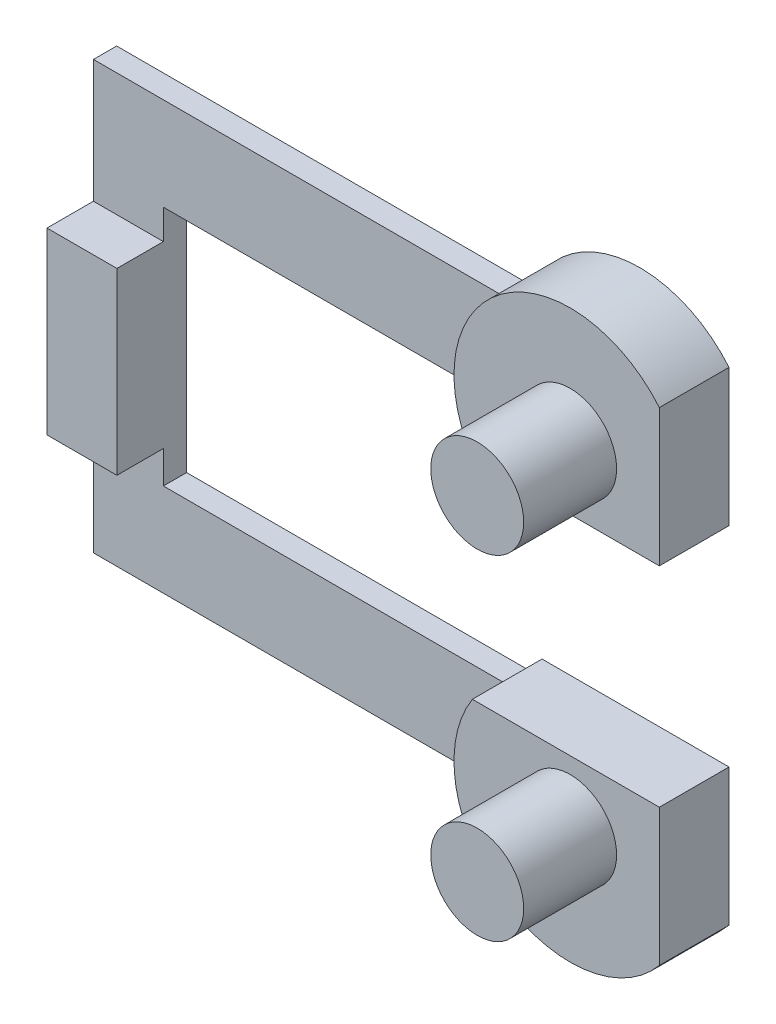
from build123d import *

# Parameters (mm, degrees)
SKIZZE2_R                         = 2
AUFSATZ_LINEAR_AUSTRAGEN1_DEPTH   = 6
AUFSATZ_LINEAR_AUSTRAGEN1_2_DEPTH = 6
SKIZZE3_W                         = 22.523994606
SKIZZE3_H                         = 4.003536954
SKIZZE3_W_2                       = 3.011174253
SKIZZE3_H_2                       = 10.396463046
AUFSATZ_LINEAR_AUSTRAGEN2_DEPTH   = 1
SKIZZE4_R                         = 5
AUFSATZ_LINEAR_AUSTRAGEN3_DEPTH   = 1
AUFSATZ_LINEAR_START              = 2
SKIZZE5_R                         = 5
AUFSATZ_LINEAR_AUSTRAGEN4_DEPTH   = 2
SKIZZE6_W                         = 13
SKIZZE6_H                         = 8.996463046
SCHNITT_LINEAR_AUSTRAGEN1_DEPTH   = 4.8
SKIZZE7_W                         = 2.020513934
SKIZZE7_H                         = 22.861740996
SCHNITT_LINEAR_AUSTRAGEN2_DEPTH   = 4.8
SKIZZE8_W                         = 3.011174253
SKIZZE8_H                         = 7.714308529
AUFSATZ_LINEAR_AUSTRAGEN5_DEPTH   = 2


with BuildPart() as part:
    # Skizze2 → Aufsatz-Linear austragen1 (new body)
    with BuildSketch(Plane.XY):
        with Locations((50.173867598, 14.290447118)):
            Circle(SKIZZE2_R)
    extrude(amount=AUFSATZ_LINEAR_AUSTRAGEN1_DEPTH)

    # Skizze3 → Aufsatz-Linear austragen2 (add)
    with BuildSketch(Plane(origin=(0, 0, 0), x_dir=(-1, 0, 0), z_dir=(0, 0, -1))):
        with Locations((-38.911870295, 14.288678641)):
            Rectangle(SKIZZE3_W, SKIZZE3_H)
        with Locations((-29.155460119, 7.088678641)):
            Rectangle(SKIZZE3_W_2, SKIZZE3_H_2)
        with BuildLine():
            Line((-30.661047245, 1.890447118), (-50.173867598, 1.890447118))
            ThreePointArc((-50.173867598, 1.890447118), (-48.759654035, 1.30466068), (-48.173867598, -0.109552882))
            ThreePointArc((-48.173867598, -0.109552882), (-48.759654035, -1.523766445), (-50.173867598, -2.109552882))
            Line((-50.173867598, -2.109552882), (-27.649872992, -2.109552882))
            Line((-27.649872992, -2.109552882), (-27.649872992, 1.890447118))
            Line((-27.649872992, 1.890447118), (-30.661047245, 1.890447118))
        make_face()
    extrude(amount=AUFSATZ_LINEAR_AUSTRAGEN2_DEPTH)



with BuildPart() as body_2:
    # Skizze2 → Aufsatz-Linear austragen1 2 (new body)
    with BuildSketch(Plane.XY):
        with Locations((50.173867598, -0.109552882)):
            Circle(SKIZZE2_R)
    extrude(amount=AUFSATZ_LINEAR_AUSTRAGEN1_2_DEPTH)


with BuildPart() as part_1:
    add(part.part)

    add(body_2.part)  # Aufsatz-Linear austragen3 merges body 2
    # Skizze4 → Aufsatz-Linear austragen3 (add)
    with BuildSketch(Plane(origin=(0, 0, 0), x_dir=(-1, 0, 0), z_dir=(0, 0, -1))):
        with Locations((-50.173867598, -0.109552882)):
            Circle(SKIZZE4_R)
        with Locations((-50.173867598, 14.290447118)):
            Circle(SKIZZE4_R)
    extrude(amount=AUFSATZ_LINEAR_AUSTRAGEN3_DEPTH)

    # Skizze5 → Aufsatz-Linear austragen4 (add)
    with BuildSketch(Plane.XY.offset(AUFSATZ_LINEAR_START)):
        with Locations((50.173867598, 14.290447118)):
            Circle(SKIZZE5_R)
        with Locations((50.173867598, -0.109552882)):
            Circle(SKIZZE5_R)
    extrude(amount=-AUFSATZ_LINEAR_AUSTRAGEN4_DEPTH)

    # Skizze6 → Schnitt-Linear austragen1 (cut)
    with BuildSketch(Plane.XY.offset(2)):
        with Locations((50.161047245, 7.088678641)):
            Rectangle(SKIZZE6_W, SKIZZE6_H)
    extrude(amount=-SCHNITT_LINEAR_AUSTRAGEN1_DEPTH, mode=Mode.SUBTRACT)

    # Skizze7 → Schnitt-Linear austragen2 (cut)
    with BuildSketch(Plane.XY.offset(2)):
        with Locations((55.025561854, 7.141160287)):
            Rectangle(SKIZZE7_W, SKIZZE7_H)
    extrude(amount=-SCHNITT_LINEAR_AUSTRAGEN2_DEPTH, mode=Mode.SUBTRACT)

    # Skizze8 → Aufsatz-Linear austragen5 (add)
    with BuildSketch(Plane.XY):
        with Locations((29.155460119, 7.145531888)):
            Rectangle(SKIZZE8_W, SKIZZE8_H)
    extrude(amount=AUFSATZ_LINEAR_AUSTRAGEN5_DEPTH)


solid = part_1.part
